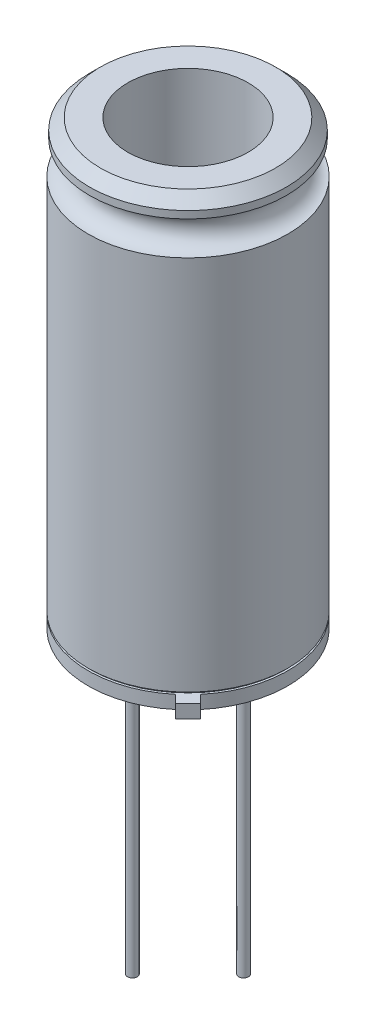
from build123d import *

# Parameters (mm, degrees)
SCHIZZO1_R                   = 4.56
ESTRUSIONE_ESTRUSIONE1_DEPTH = 19.5
SCHIZZO2_R                   = 0.75
SCHIZZO3_W                   = 2.392896604
SCHIZZO3_H                   = 1.50856525
SMUSSO1_SIZE                 = 0.5
FORO_PER_VITE_M5_1_D         = 5.5
ESTRUSIONE_ESTRUSIONE2_DEPTH = 0.6
SCHIZZO9_R                   = 0.8
TAGLIO_ESTRUSIONE1_DEPTH     = 0.6
SCHIZZO10_R                  = 0.225
ESTRUSIONE_ESTRUSIONE3_DEPTH = 13


with BuildPart() as part:
    # Schizzo1 → Estrusione-Estrusione1 (new body)
    with BuildSketch(Plane(origin=(0, 0, 0), x_dir=(1, 0, 0), z_dir=(0, 1, 0))):
        with Locations(Location((0, 0, 0), (0, 0, 270))):
            Circle(SCHIZZO1_R)
    extrude(amount=ESTRUSIONE_ESTRUSIONE1_DEPTH)

    # Schizzo2 → Taglia-Rivoluzione1 (revolve, cut)
    with BuildSketch(Plane.XY, mode=Mode.PRIVATE) as taglia_rivoluzione1_sk:
        with Locations((-4.56, 17.92)):
            Circle(SCHIZZO2_R)
    revolve(taglia_rivoluzione1_sk.sketch.rotate(Axis((0, 19.5, 0), (0, -1, 0)), 270), axis=Axis((0, 19.5, 0), (0, -1, 0)), mode=Mode.SUBTRACT)

    # Schizzo3 → Taglia-Rivoluzione2 (revolve, cut)
    with BuildSketch(Plane.XY, mode=Mode.PRIVATE) as taglia_rivoluzione2_sk:
        with Locations((-5.696448302, 18.983195512)):
            Rectangle(SCHIZZO3_W, SCHIZZO3_H)
    revolve(taglia_rivoluzione2_sk.sketch.rotate(Axis((0, 19.5, 0), (0, -1, 0)), 270), axis=Axis((0, 19.5, 0), (0, -1, 0)), mode=Mode.SUBTRACT)

    # Smusso1
    smusso1_edges = [part.edges().sort_by_distance(p)[0] for p in [
        (0, 19.5, -4.5),
    ]]
    chamfer(smusso1_edges, length=SMUSSO1_SIZE)

    # Foro per Vite M5-1 (through all)
    with Locations(Plane.ZX.offset(19.5)):
        with Locations((0, 0)):
            Hole(FORO_PER_VITE_M5_1_D / 2)


with BuildPart() as body_2:
    # Schizzo7 → Rivoluzione1 (revolve)
    with BuildSketch(Plane.XY):
        Polygon((0, 0), (0, -0.7), (-4.56, -0.7), (-4.56, -0.1), (-4.46, -0.1), (-4.46, 0), align=None)
    revolve(axis=Axis((0, 0, 0), (0, -1, 0)))

    # Schizzo8 → Estrusione-Estrusione2 (add)
    with BuildSketch(Plane.XZ.offset(0.7)):
        Polygon((0.282842712, -0.282842712), (3.860803025, 3.2951176), (3.577960313, 3.577960313), (3.2951176, 3.860803025), (-0.282842712, 0.282842712), align=None)
    extrude(amount=-ESTRUSIONE_ESTRUSIONE2_DEPTH)

    # Schizzo9 → Taglio-Estrusione1 (cut)
    with BuildSketch(Plane.XZ.offset(0.7)):
        with Locations((2.54, 0)):
            Circle(SCHIZZO9_R)
        with Locations((0, -2.54)):
            Circle(SCHIZZO9_R)
        with Locations((-2.54, 0)):
            Circle(SCHIZZO9_R)
    extrude(amount=-TAGLIO_ESTRUSIONE1_DEPTH, mode=Mode.SUBTRACT)

    # Schizzo10 → Estrusione-Estrusione3 (add)
    with BuildSketch(Plane.XZ.offset(0.1)):
        with Locations((0, 2.54)):
            Circle(SCHIZZO10_R)
        with Locations(Location((2.54, 0, 0), (0, 0, 180))):
            Circle(SCHIZZO10_R)
        with Locations(Location((0, -2.54, 0), (0, 0, 180))):
            Circle(SCHIZZO10_R)
        with Locations(Location((-2.54, 0, 0), (0, 0, 180))):
            Circle(SCHIZZO10_R)
    extrude(amount=ESTRUSIONE_ESTRUSIONE3_DEPTH)


solid = Compound([part.part, body_2.part])
